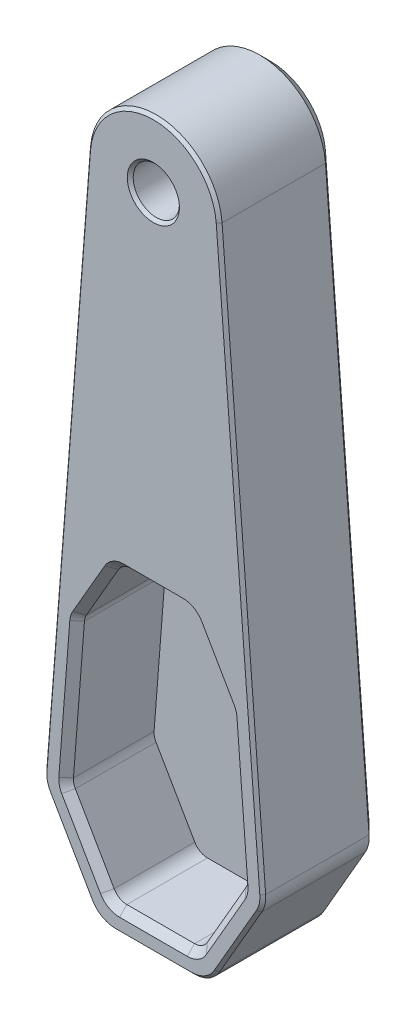
from build123d import *

# Parameters (mm, degrees)
BOSS_EXTRUDE2_DEPTH  = 8
ROD_POCKET_DEPTH     = 6
POCKET_FILLETS_R     = 1
PROFILE_FILLETS_R    = 2
INSERT_CHAM_SIZE     = 0.5
SKETCH6_R            = 2.875
COUNTERSINK_DEPTH    = 2.6
SKETCH7_R            = 1.575
THROUGH_HOLE_DEPTH   = 47.262360557
DEBURS_SIZE          = 0.2
OUTSIDE_CHAMFER_SIZE = 0.75


with BuildPart() as part:
    # Sketch1 → Boss-Extrude2 (new body)
    with BuildSketch(Plane.XY):
        with BuildLine():
            Line((-7.505553499, -38.45), (-4.486437749, 0.349107895))
            ThreePointArc((-4.486437749, 0.349107895), (0, 4.5), (4.486437749, 0.349107895))
            Line((4.486437749, 0.349107895), (7.505553499, -38.45))
            Line((7.505553499, -38.45), (3.75277675, -44.95))
            Line((3.75277675, -44.95), (-3.75277675, -44.95))
            Line((-3.75277675, -44.95), (-7.505553499, -38.45))
        make_face()
    extrude(amount=BOSS_EXTRUDE2_DEPTH)

    # Sketch5 → Rod Pocket (cut)
    with BuildSketch(Plane.XY.offset(8)):
        Polygon((5.183091381, -27.938688806), (2.59154569, -23.45), (-2.59154569, -23.45), (-5.183091381, -27.938688806), (-5.973996897, -38.102733849), (-2.886751346, -43.45), (2.886751346, -43.45), (5.973996897, -38.102733849), align=None)
    extrude(amount=-ROD_POCKET_DEPTH, mode=Mode.SUBTRACT)

    # Pocket Fillets
    pocket_fillets_edges = [part.edges().sort_by_distance(p)[0] for p in [
        (2.59154569, -23.45, 5),
        (-2.59154569, -23.45, 5),
        (-5.183091381, -27.938688806, 5),
        (-5.973996897, -38.102733849, 5),
        (-2.886751346, -43.45, 5),
        (2.886751346, -43.45, 5),
        (5.973996897, -38.102733849, 5),
        (5.183091381, -27.938688806, 5),
    ]]
    fillet(pocket_fillets_edges, radius=POCKET_FILLETS_R)

    # Profile Fillets
    profile_fillets_edges = [part.edges().sort_by_distance(p)[0] for p in [
        (7.505553499, -38.45, 4),
        (3.75277675, -44.95, 4),
        (-3.75277675, -44.95, 4),
        (-7.505553499, -38.45, 4),
    ]]
    fillet(profile_fillets_edges, radius=PROFILE_FILLETS_R)

    # Insert Cham
    insert_cham_edges = [part.edges().sort_by_distance(p)[0] for p in [
        (-5.575313572, -32.979194827, 8),
        (-3.974970938, -25.846162818, 8),
        (-4.497205523, -40.660611541, 8),
        (0, -43.45, 8),
        (4.497205523, -40.660611541, 8),
        (5.575313572, -32.979194827, 8),
        (3.974970938, -25.846162818, 8),
        (0, -23.45, 8),
        (-5.158846312, -27.946205375, 8),
        (-5.928204033, -38.092350745, 8),
        (-2.809401077, -43.316025404, 8),
        (2.809401077, -43.316025404, 8),
        (5.928204033, -38.092350745, 8),
        (5.158846312, -27.946205375, 8),
        (2.514195421, -23.583974596, 8),
        (-2.514195421, -23.583974596, 8),
    ]]
    chamfer(insert_cham_edges, length=INSERT_CHAM_SIZE)

    # Sketch6 → Countersink (cut)
    with BuildSketch(Plane(origin=(0, 0, 0), x_dir=(-1, 0, 0), z_dir=(0, 0, -1))):
        Circle(SKETCH6_R)
    extrude(amount=-COUNTERSINK_DEPTH, mode=Mode.SUBTRACT)

    # Sketch7 → Through Hole (cut, through all)
    with BuildSketch(Plane.XY):
        with Locations(Location((0, 0, 0), (0, 0, 180))):
            Circle(SKETCH7_R)
    extrude(amount=THROUGH_HOLE_DEPTH, mode=Mode.SUBTRACT)

    # Deburs
    deburs_edges = [part.edges().sort_by_distance(p)[0] for p in [
        (5.762827928, -41.468489233, 8),
        (-5.762827928, -41.468489233, 8),
        (0, -44.95, 8),
        (-3.598076211, -44.682050808, 8),
        (3.598076211, -44.682050808, 8),
        (-7.41396777, -38.429233792, 8),
        (7.41396777, -38.429233792, 8),
        (2.875, 0, 0),
        (1.575, 0, 2.6),
        (1.575, 0, 8),
        (0, 4.5, 8),
        (-5.971944056, -18.741355754, 8),
        (5.971944056, -18.741355754, 8),
    ]]
    chamfer(deburs_edges, length=DEBURS_SIZE)

    # Outside Chamfer
    outside_chamfer_edges = [part.edges().sort_by_distance(p)[0] for p in [
        (-3.598076211, -44.682050808, 0),
        (3.598076211, -44.682050808, 0),
        (-7.41396777, -38.429233792, 0),
        (7.41396777, -38.429233792, 0),
        (-5.971944056, -18.741355754, 0),
        (0, 4.5, 0),
        (5.971944056, -18.741355754, 0),
        (5.762827928, -41.468489233, 0),
        (0, -44.95, 0),
        (-5.762827928, -41.468489233, 0),
    ]]
    chamfer(outside_chamfer_edges, length=OUTSIDE_CHAMFER_SIZE)


solid = part.part
